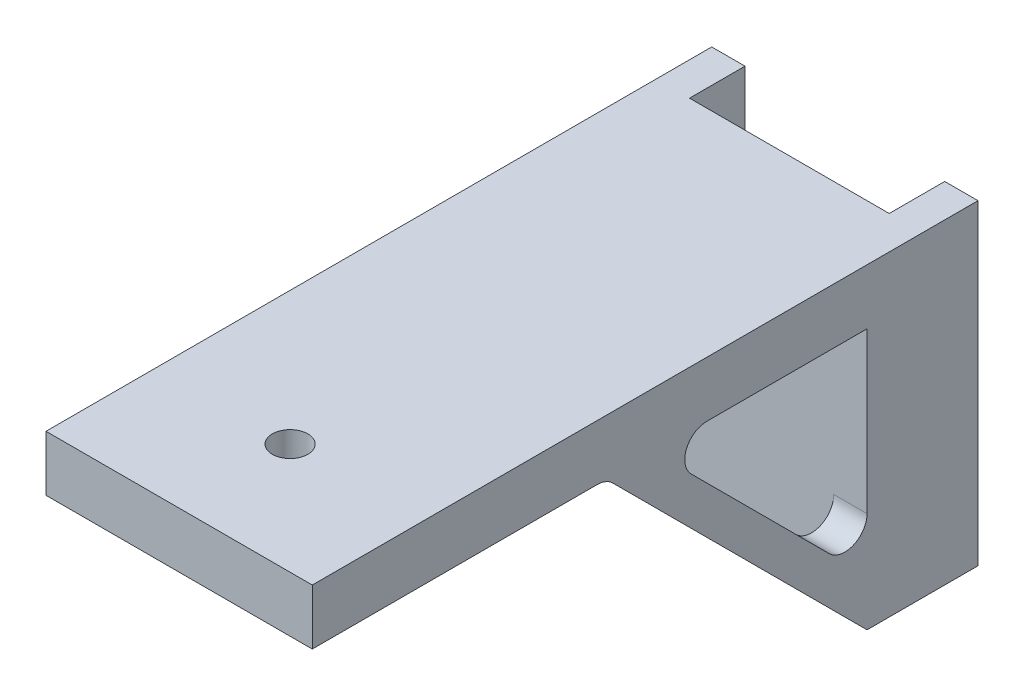
from build123d import *

# Parameters (mm, degrees)
SKETCH1_R           = 1.6
BOSS_EXTRUDE1_DEPTH = 5
SKETCH2_W           = 3
SKETCH2_H           = 28.5
BOSS_EXTRUDE2_DEPTH = 10
SKETCH3_W           = 24
SKETCH3_H           = 50
SKETCH3_R           = 1.6
BOSS_EXTRUDE3_DEPTH = 5
BOSS_EXTRUDE4_DEPTH = 3
BOSS_EXTRUDE5_START = -24
BOSS_EXTRUDE5_DEPTH = 3
BOSS_EXTRUDE6_DEPTH = 2.4
FILLET1_R           = 2


with BuildPart() as part:
    # Sketch1 → Boss-Extrude1 (new body)
    with BuildSketch(Plane.XY):
        Polygon((-9, -8.5), (-9, 8.5), (9, 8.5), (9, -8.5), (9, -20), (-9, -20), align=None)
        Circle(SKETCH1_R, mode=Mode.SUBTRACT)
    extrude(amount=BOSS_EXTRUDE1_DEPTH)

    # Sketch2 → Boss-Extrude2 (add)
    with BuildSketch(Plane.XY.offset(5)):
        with Locations((-10.5, -5.75)):
            Rectangle(SKETCH2_W, SKETCH2_H)
        with Locations((10.5, -5.75)):
            Rectangle(SKETCH2_W, SKETCH2_H)
    extrude(amount=-BOSS_EXTRUDE2_DEPTH)

    # Sketch3 → Boss-Extrude3 (add)
    with BuildSketch(Plane(origin=(0, 8.5, 0), x_dir=(1, 0, 0), z_dir=(0, 1, 0))):
        with Locations((0, -30)):
            Rectangle(SKETCH3_W, SKETCH3_H)
        with Locations(Location((0, -45, 0), (0, 0, 270))):
            Circle(SKETCH3_R, mode=Mode.SUBTRACT)
    extrude(amount=-BOSS_EXTRUDE3_DEPTH)

    # Sketch4 → Boss-Extrude4 (add)
    with BuildSketch(Plane.ZY.offset(12)):
        Polygon((28.5, 3.5), (24.257359313, 3.5), (5, -15.757359313), (5, -20), align=None)
    extrude(amount=-BOSS_EXTRUDE4_DEPTH)

    # Sketch4<3> → Boss-Extrude5 (add)
    with BuildSketch(Plane.ZY.offset(12).offset(BOSS_EXTRUDE5_START)):
        Polygon((28.5, 3.5), (24.257359313, 3.5), (5, -15.757359313), (5, -20), align=None)
    extrude(amount=BOSS_EXTRUDE5_DEPTH)

    # Sketch5 → Boss-Extrude6 (add)
    with BuildSketch(Plane.XY.offset(5)):
        Polygon((-5, 3.5), (-5, 2.886751346), (-5, -2.886751346), (0, -5.773502692), (5, -2.886751346), (5, 2.886751346), (5, 3.5), align=None)
        Polygon((3, -1.732050808), (0, -3.464101615), (-3, -1.732050808), (-3, 1.732050808), (0, 3.464101615), (3, 1.732050808), align=None, mode=Mode.SUBTRACT)
    extrude(amount=BOSS_EXTRUDE6_DEPTH)

    # Fillet1
    fillet1_edges = [part.edges().sort_by_distance(p)[0] for p in [
        (-10.5, 3.5, 24.257359313),
        (-10.5, 3.5, 28.5),
        (-10.5, -15.757359313, 5),
        (10.5, -15.757359313, 5),
        (10.5, 3.5, 28.5),
        (10.5, 3.5, 24.257359313),
    ]]
    fillet(fillet1_edges, radius=FILLET1_R)


solid = part.part
